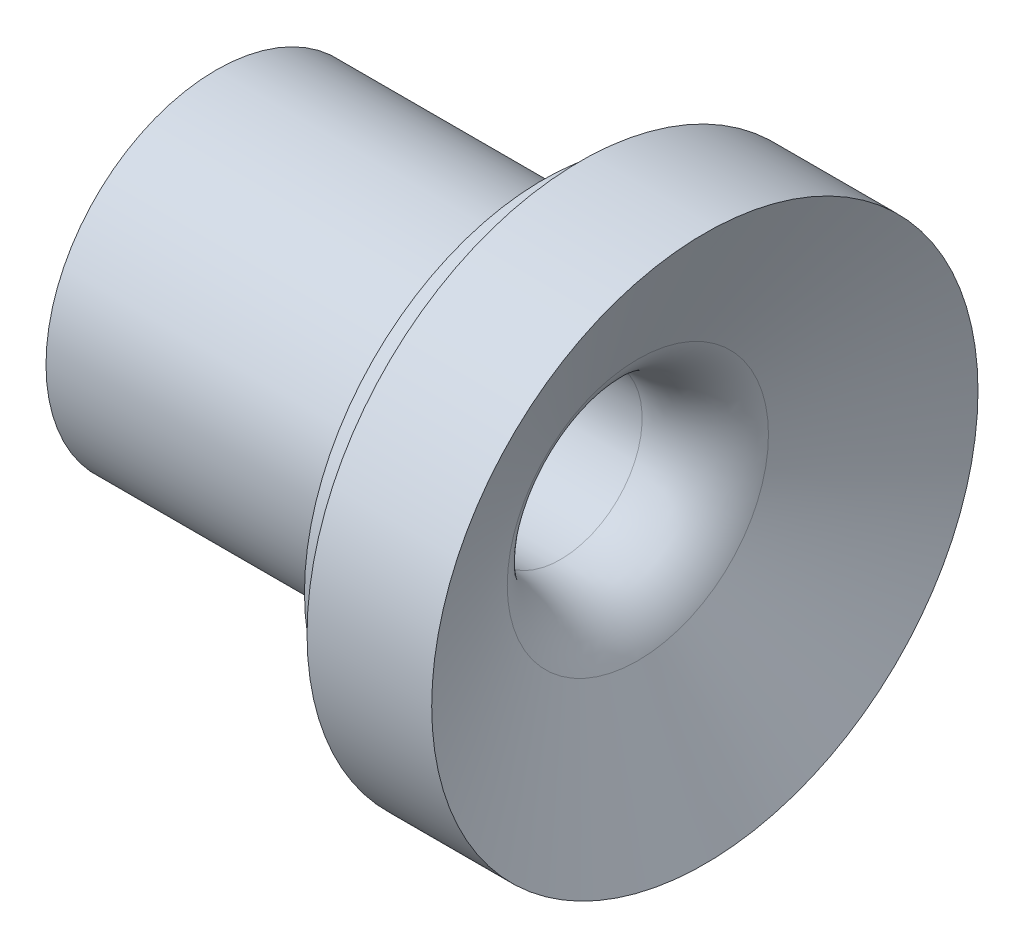
from build123d import *

# Parameters (mm, degrees)
SCALE1_SCALE = 1.70603675


with BuildPart() as part:
    # Esquisse1 → Révolution1 (revolve)
    with BuildSketch(Plane.XY, mode=Mode.PRIVATE) as r_volution1_sk:
        with BuildLine():
            Line((1.981656821, 8.97797736), (7.823456821, 8.97797736))
            Line((7.823456821, 8.97797736), (4.683813218, 2.298439639))
            ThreePointArc((4.683813218, 2.298439639), (3.207806254, 0.623149289), (1.06377284, 0))
            Line((1.06377284, 0), (0.803456821, 0))
            Line((0.803456821, 0), (-5.036543179, 0))
            Line((-5.036543179, 0), (-15.076543179, 1.81597736))
            Line((-15.076543179, 1.81597736), (-15.076543179, 4.15197736))
            Line((-15.076543179, 4.15197736), (-2.000513414, 4.15197736))
            ThreePointArc((-2.000513414, 4.15197736), (-1.65849327, 4.212284739), (-1.357725804, 4.385932917))
            Line((-1.357725804, 4.385932917), (-0.12815557, 5.417664847))
            ThreePointArc((-0.12815557, 5.417664847), (0.135364608, 5.761091028), (0.229056821, 6.18370929))
            Line((0.229056821, 6.18370929), (0.229056821, 7.34597736))
            Line((0.229056821, 7.34597736), (1.981656821, 7.34597736))
            Line((1.981656821, 7.34597736), (1.981656821, 8.97797736))
        make_face()
    revolve(r_volution1_sk.sketch.rotate(Axis((-19.476947674, -3.82202264, 0), (1, 0, 0)), 90), axis=Axis((-19.476947674, -3.82202264, 0), (1, 0, 0)))


with BuildPart() as part_1:
    # Scale1: scaled about (-1.246951402, -3.82202264, 0)
    add(part.part.scale(SCALE1_SCALE).moved(Location((0.880393515, 2.698488443, 0))))


solid = part_1.part
